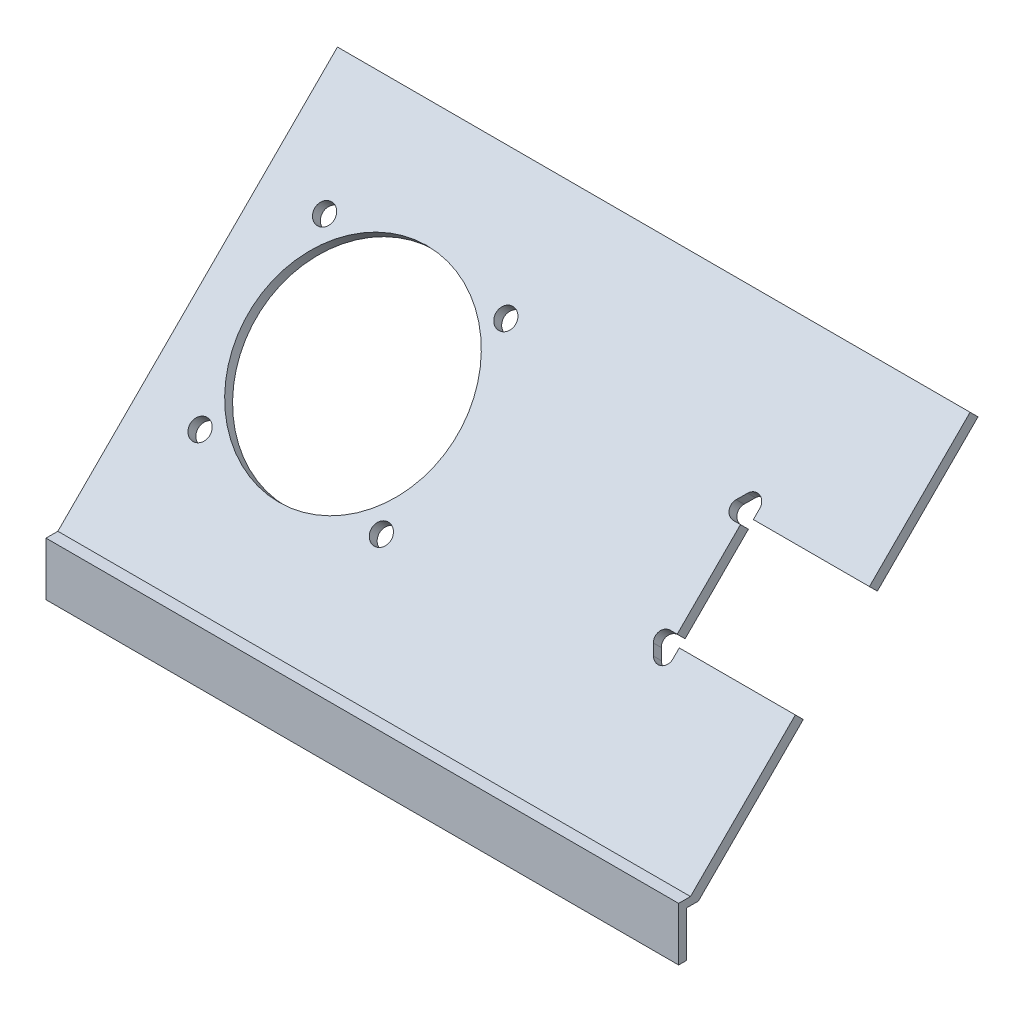
from build123d import *

# Parameters (mm, degrees)
BOSS_EXTRUDE1_DEPTH = 160
BOSS_EXTRUDE2_DEPTH = 160
SKETCH4_W           = 31.25
SKETCH4_H           = 14
SKETCH4_H_2         = 12.5
CUT_EXTRUDE1_DEPTH  = 10
CUT_EXTRUDE2_DEPTH  = 10
SKETCH6_R           = 26.5
CUT_EXTRUDE3_DEPTH  = 10
SKETCH7_R           = 2.5
CUT_EXTRUDE4_DEPTH  = 10


with BuildPart() as part:
    # Sketch1 → Boss-Extrude1 (new body)
    with BuildSketch(Plane(origin=(0, 0, 0), x_dir=(0, 0, -1), z_dir=(1, 0, 0))):
        Polygon((0, 0), (0, 11.5), (3, 11.5), (3, 13.5), (-2, 13.5), (-2, 0), align=None)
    extrude(amount=BOSS_EXTRUDE1_DEPTH)

    # Sketch2 → Boss-Extrude2 (add)
    with BuildSketch(Plane(origin=(0, 0, 0), x_dir=(0, 0, -1), z_dir=(1, 0, 0))):
        Polygon((3, 13.5), (3, 11.5), (24.213203436, 32.713203436), (73.710678119, 82.210678119), (71.710678119, 84.210678119), (22.213203436, 34.713203436), (1, 13.5), align=None)
    extrude(amount=BOSS_EXTRUDE2_DEPTH)

    # Sketch4 → Cut-Extrude1 (cut)
    with BuildSketch(Plane(origin=(0, 6.25, 6.25), x_dir=(1, 0, 0), z_dir=(0, 0.7071067811865477, 0.7071067811865475))):
        with Locations((144.375, 67.253048327)):
            Rectangle(SKETCH4_W, SKETCH4_H)
        with Locations((144.375, 54.003048327)):
            Rectangle(SKETCH4_W, SKETCH4_H_2)
    extrude(amount=-CUT_EXTRUDE1_DEPTH, mode=Mode.SUBTRACT)

    # Sketch5 → Cut-Extrude2 (cut)
    with BuildSketch(Plane(origin=(0, 6.25, 6.25), x_dir=(1, 0, 0), z_dir=(0, 0.7071067811865477, 0.7071067811865475))):
        with BuildLine():
            Line((128.75, 74.253048327), (130.644024073, 74.253048327))
            Line((130.644024073, 74.253048327), (130.644024073, 76.548206166))
            ThreePointArc((130.644024073, 76.548206166), (129.12196275, 78.639811919), (126.663600689, 77.834863927))
            Line((126.663600689, 77.834863927), (125.199975137, 75.807473041))
            ThreePointArc((125.199975137, 75.807473041), (125.025166605, 73.519904499), (126.982233047, 72.322649807))
            Line((126.982233047, 72.322649807), (128.75, 72.322649807))
            Line((128.75, 72.322649807), (128.75, 74.253048327))
        make_face()
        with BuildLine():
            Line((128.75, 49.683446848), (126.982233047, 49.683446848))
            ThreePointArc((126.982233047, 49.683446848), (125.025166605, 48.486192156), (125.199975137, 46.198623614))
            Line((125.199975137, 46.198623614), (126.663600689, 44.171232728))
            ThreePointArc((126.663600689, 44.171232728), (129.12196275, 43.366284735), (130.644024073, 45.457890488))
            Line((130.644024073, 45.457890488), (130.644024073, 47.753048327))
            Line((130.644024073, 47.753048327), (128.75, 47.753048327))
            Line((128.75, 47.753048327), (128.75, 49.683446848))
        make_face()
    extrude(amount=-CUT_EXTRUDE2_DEPTH, mode=Mode.SUBTRACT)

    # Sketch6 → Cut-Extrude3 (cut)
    with BuildSketch(Plane(origin=(0, 6.25, 6.25), x_dir=(1, 0, 0), z_dir=(0, 0.7071067811865477, 0.7071067811865475))):
        with Locations(Location((38.75, 61.003048327, 0), (0, 0, 270))):
            Circle(SKETCH6_R)
    extrude(amount=-CUT_EXTRUDE3_DEPTH, mode=Mode.SUBTRACT)

    # Sketch7 → Cut-Extrude4 (cut)
    with BuildSketch(Plane(origin=(0, 6.25, 6.25), x_dir=(1, 0, 0), z_dir=(0, 0.7071067811865477, 0.7071067811865475))):
        with Locations(Location((15.82638188, 83.269496377, 0), (0, 0, 270))):
            Circle(SKETCH7_R)
        with Locations(Location((15.82638188, 38.736600277, 0), (0, 0, 270))):
            Circle(SKETCH7_R)
        with Locations(Location((61.67361812, 38.736600277, 0), (0, 0, 270))):
            Circle(SKETCH7_R)
        with Locations(Location((61.67361812, 83.269496377, 0), (0, 0, 270))):
            Circle(SKETCH7_R)
    extrude(amount=-CUT_EXTRUDE4_DEPTH, mode=Mode.SUBTRACT)


solid = part.part
